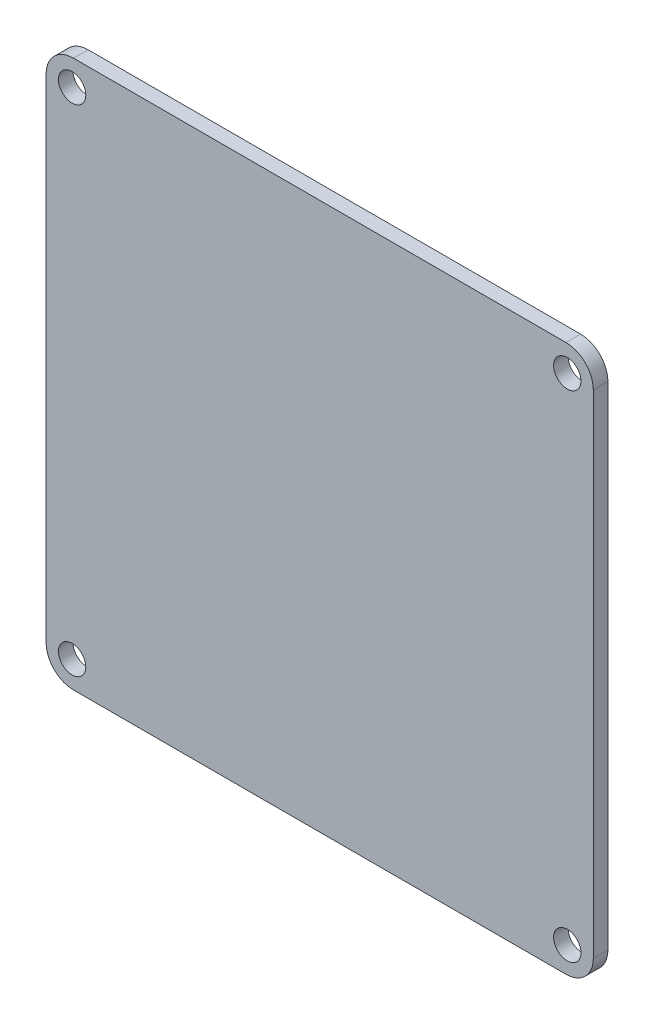
from build123d import *

# Parameters (mm, degrees)
SKETCH_1_W          = 60
SKETCH_1_H          = 60
EXTRUDE_2_DEPTH     = 1.6
SKETCH_3_R          = 1.5
CUT_EXTRUDE_1_DEPTH = 19.6
FILLET_1_R          = 3
FILLET_2_R          = 3
FILLET_3_R          = 3
FILLET_4_R          = 3


with BuildPart() as part:
    # 草图1 → 凸台-拉伸2 (new body)
    with BuildSketch(Plane.XY):
        with Locations((30, -30)):
            Rectangle(SKETCH_1_W, SKETCH_1_H)
    extrude(amount=EXTRUDE_2_DEPTH)

    # 草图3 → 切除-拉伸1 (cut)
    with BuildSketch(Plane(origin=(0, 0, 0), x_dir=(-1, 0, 0), z_dir=(0, 0, -1))):
        with Locations((-57.15, -2.85)):
            Circle(SKETCH_3_R)
        with Locations((-2.85, -2.85)):
            Circle(SKETCH_3_R)
        with Locations((-2.85, -57.15)):
            Circle(SKETCH_3_R)
        with Locations((-57.15, -57.15)):
            Circle(SKETCH_3_R)
    extrude(amount=-CUT_EXTRUDE_1_DEPTH, mode=Mode.SUBTRACT)

    # 圆角1
    fillet_1_edges = [part.edges().sort_by_distance(p)[0] for p in [
        (60, 0, 0.8),
    ]]
    fillet(fillet_1_edges, radius=FILLET_1_R)

    # 圆角2
    fillet_2_edges = [part.edges().sort_by_distance(p)[0] for p in [
        (0, 0, 0.8),
    ]]
    fillet(fillet_2_edges, radius=FILLET_2_R)

    # 圆角3
    fillet_3_edges = [part.edges().sort_by_distance(p)[0] for p in [
        (0, -60, 0.8),
    ]]
    fillet(fillet_3_edges, radius=FILLET_3_R)

    # 圆角4
    fillet_4_edges = [part.edges().sort_by_distance(p)[0] for p in [
        (60, -60, 0.8),
    ]]
    fillet(fillet_4_edges, radius=FILLET_4_R)


solid = part.part
